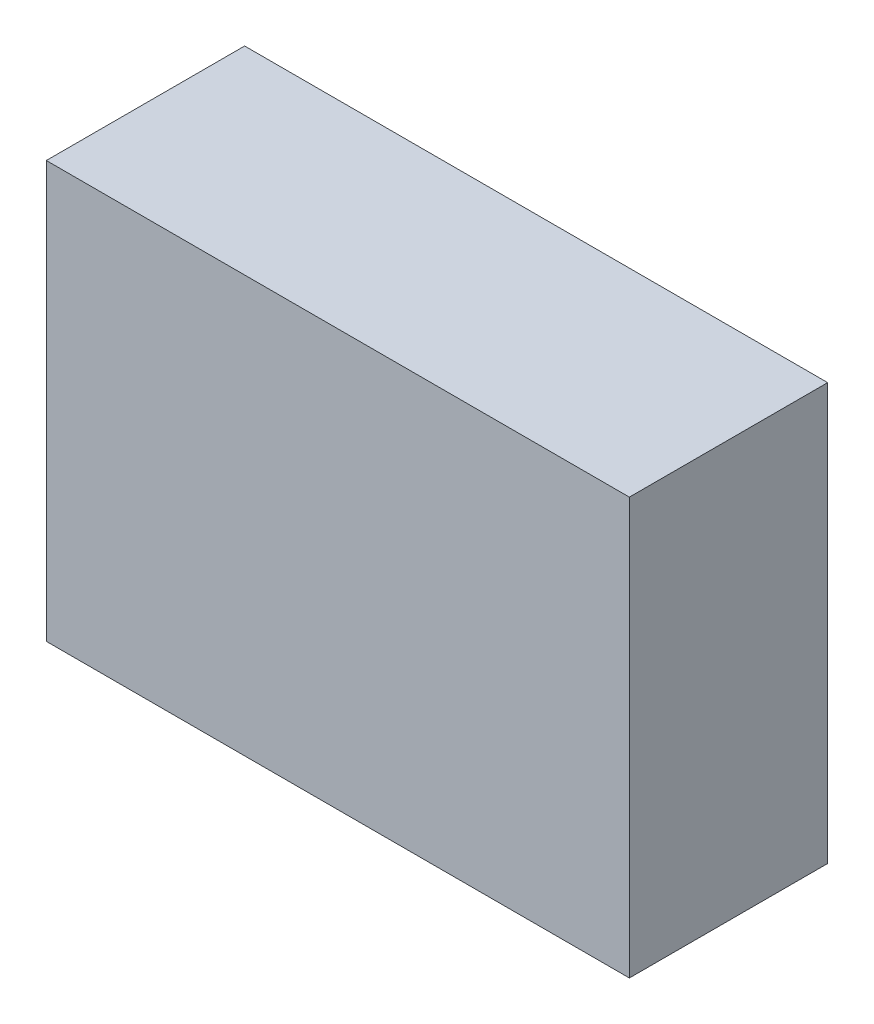
from build123d import *

# Parameters (mm, degrees)
SKETCH1_W           = 147
SKETCH1_H           = 105
BOSS_EXTRUDE1_DEPTH = 50


with BuildPart() as part:
    # Sketch1 → Boss-Extrude1 (new body)
    with BuildSketch(Plane.XY):
        with Locations((-63.114130435, 50.95923913)):
            Rectangle(SKETCH1_W, SKETCH1_H)
    extrude(amount=BOSS_EXTRUDE1_DEPTH)


solid = part.part
